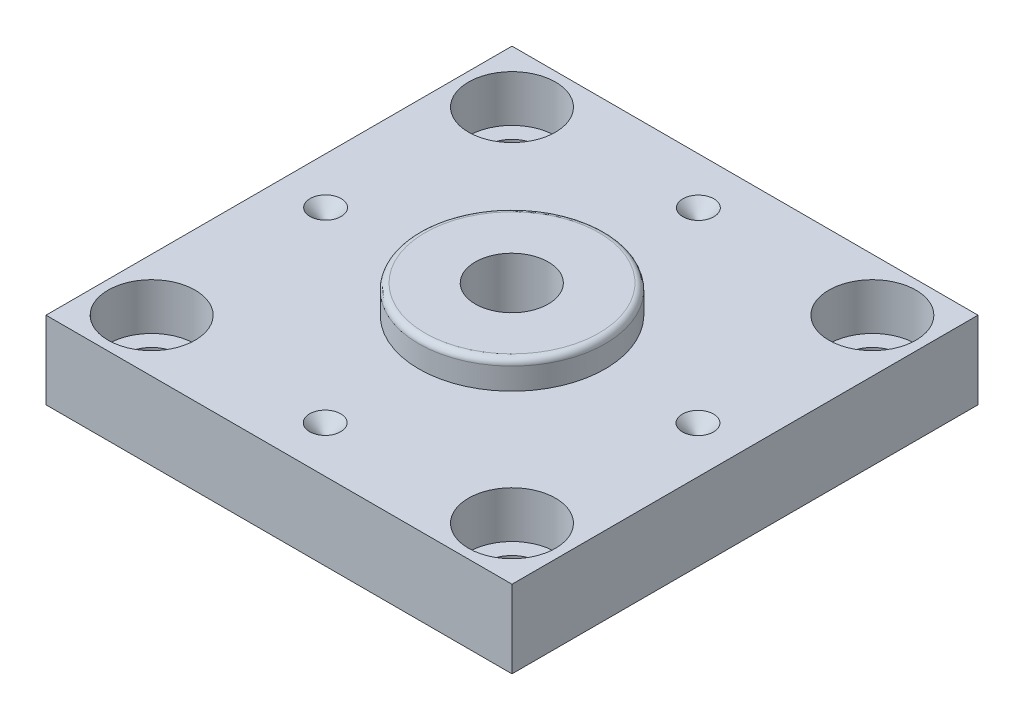
from build123d import *

# Parameters (mm, degrees)
IZIM2_W                     = 150
IZIM2_H                     = 150
Y_KSEKLIK_EKSTR_ZYON1_DEPTH = 25
IZIM3_R                     = 30
Y_KSEKLIK_EKSTR_ZYON2_DEPTH = 9
RADYUS1_R                   = 2
M25X1_5_DI_LI_DELIK2_D      = 23.5
DELIK1_D                    = 17
DELIK1_CBORE_D              = 28
DELIK1_CBORE_DEPTH          = 15
DAIRESEL_KAPLAMA2_COUNT     = 4


with BuildPart() as part:
    # Çizim2 → Yükseklik-Ekstrüzyon1 (new body)
    with BuildSketch(Plane(origin=(0, 0, 0), x_dir=(1, 0, 0), z_dir=(0, 1, 0))):
        Rectangle(IZIM2_W, IZIM2_H)
    extrude(amount=Y_KSEKLIK_EKSTR_ZYON1_DEPTH)

    # Çizim3 → Yükseklik-Ekstrüzyon2 (add)
    with BuildSketch(Plane(origin=(0, 25, 0), x_dir=(1, 0, 0), z_dir=(0, 1, 0))):
        with Locations(Location((0, 0, 0), (0, 0, 270))):
            Circle(IZIM3_R)
    extrude(amount=Y_KSEKLIK_EKSTR_ZYON2_DEPTH)

    # Radyus1
    radyus1_edges = [part.edges().sort_by_distance(p)[0] for p in [
        (0, 34, -30),
    ]]
    fillet(radyus1_edges, radius=RADYUS1_R)

    # M25x1.5 Dişli Delik2 (through all)
    with Locations(Plane(origin=(-0.00426246, 34, 0.065902754), x_dir=(0, 0, 1), z_dir=(0, 1, 0))):
        with Locations((0, 0)):
            Hole(M25X1_5_DI_LI_DELIK2_D / 2)

    # Delik1 (through all)
    with Locations(Plane(origin=(-57.998400022, 25, -57.998400022), x_dir=(0, 0, 1), z_dir=(0, 1, 0))):
        with Locations((0, 0), (0, 116), (116, 116), (116, 0)):
            CounterBoreHole(DELIK1_D / 2, DELIK1_CBORE_D / 2, DELIK1_CBORE_DEPTH)

    # Çizim8 → Kes-Döndür1 (revolve, cut)
    with BuildSketch(Plane.XY, mode=Mode.PRIVATE) as kes_d_nd_r1_sk:
        Polygon((-65, 25), (-60, 20), (-60, 25), align=None)
    kes_d_nd_r1 = revolve(kes_d_nd_r1_sk.sketch.rotate(Axis((-60, 20, 0), (0, 1, 0)), 90), axis=Axis((-60, 20, 0), (0, 1, 0)), mode=Mode.SUBTRACT)

    # Dairesel Kaplama2: Kes-Döndür1 ×4 about axis
    dairesel_kaplama2_axis = Axis((-0.00426246, 0, 0.065902754), (0, 1, 0))
    for i in range(1, DAIRESEL_KAPLAMA2_COUNT):
        add(kes_d_nd_r1.rotate(dairesel_kaplama2_axis, i * 360 / DAIRESEL_KAPLAMA2_COUNT), mode=Mode.SUBTRACT)


solid = part.part
